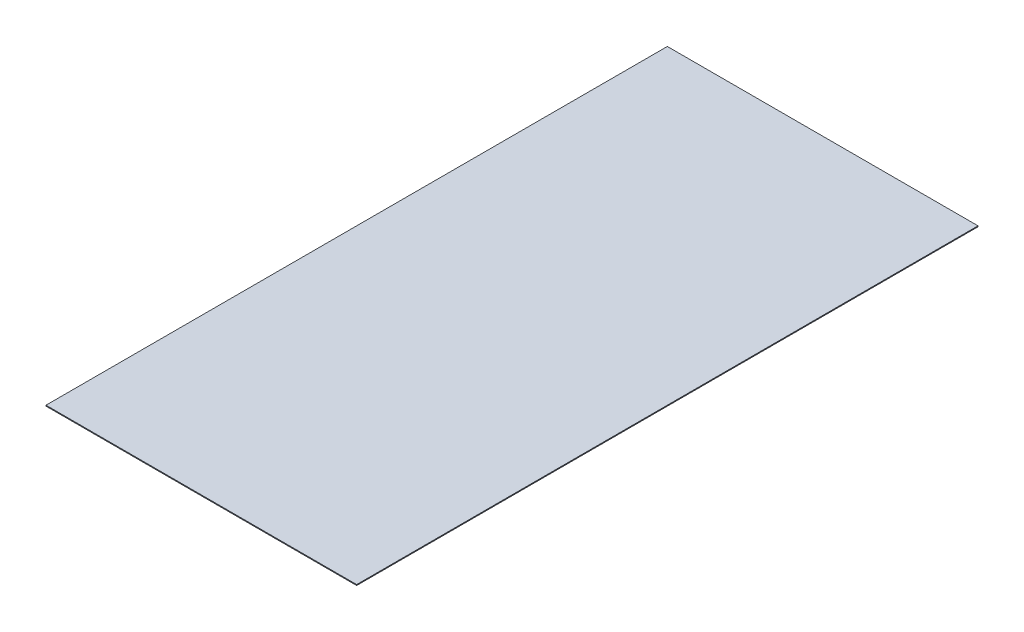
from build123d import *

# Parameters (mm, degrees)
CROQUIS1_W              = 1219.2
CROQUIS1_H              = 2438.4
SALIENTE_EXTRUIR1_DEPTH = 3.4


with BuildPart() as part:
    # Croquis1 → Saliente-Extruir1 (new body)
    with BuildSketch(Plane(origin=(0, 0, 0), x_dir=(1, 0, 0), z_dir=(0, 1, 0))):
        Rectangle(CROQUIS1_W, CROQUIS1_H)
    extrude(amount=SALIENTE_EXTRUIR1_DEPTH)


solid = part.part
